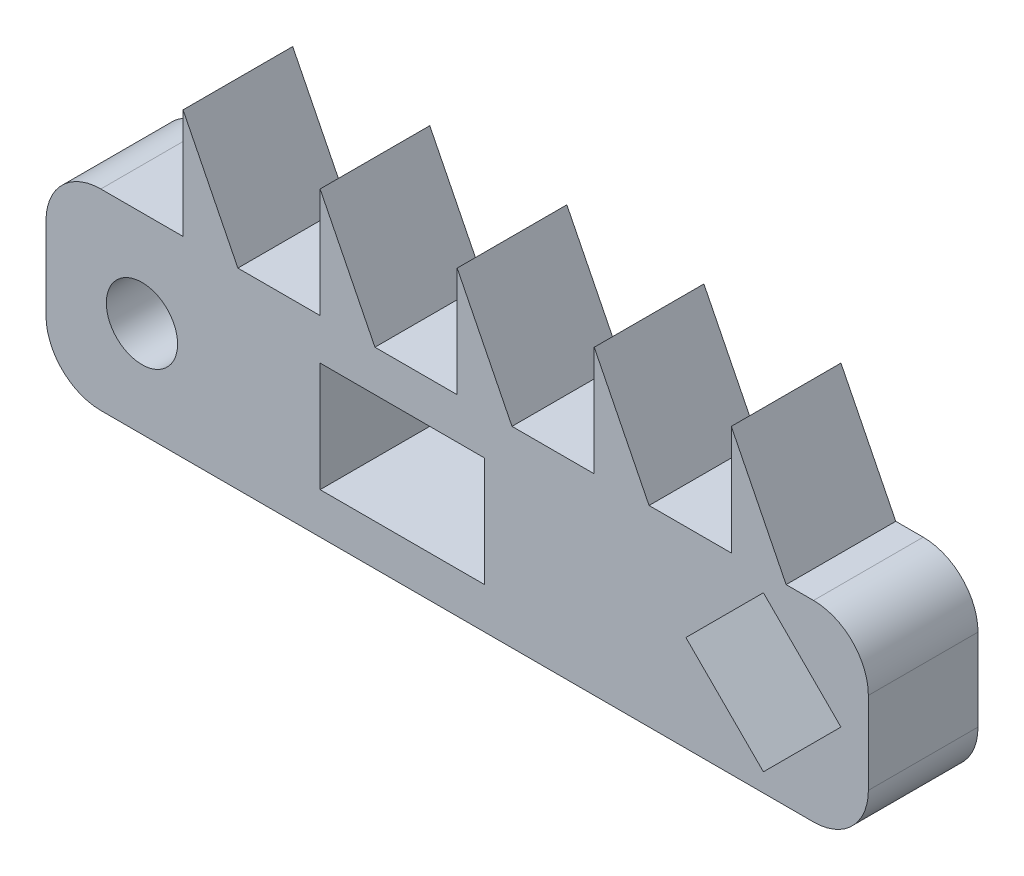
from build123d import *

# Parameters (mm, degrees)
SKETCH_1_R      = 1.3
SKETCH_1_W      = 6
SKETCH_1_H      = 4
EXTRUDE_1_DEPTH = 4
EXTRUDE_2_DEPTH = 4


with BuildPart() as part:
    # Эскиз1 → Бобышка-Вытянуть1 (new body)
    with BuildSketch(Plane.XY):
        with BuildLine():
            Line((2, 0), (28, 0))
            ThreePointArc((28, 0), (29.414213562, 0.585786438), (30, 2))
            Line((30, 2), (30, 5))
            ThreePointArc((30, 5), (29.414213562, 6.414213562), (28, 7))
            Line((28, 7), (2, 7))
            ThreePointArc((2, 7), (0.585786438, 6.414213562), (0, 5))
            Line((0, 5), (0, 2))
            ThreePointArc((0, 2), (0.585786438, 0.585786438), (2, 0))
        make_face()
        with Locations((3.5, 3.5)):
            Circle(SKETCH_1_R, mode=Mode.SUBTRACT)
        Polygon((23.343145751, 3.5), (26.171572875, 6.328427125), (29, 3.5), (26.171572875, 0.671572875), align=None, mode=Mode.SUBTRACT)
        with Locations((13, 3.5)):
            Rectangle(SKETCH_1_W, SKETCH_1_H, mode=Mode.SUBTRACT)
    extrude(amount=EXTRUDE_1_DEPTH)

    # Эскиз2 → Бобышка-Вытянуть2 (add)
    with BuildSketch(Plane.XY.offset(4)):
        Polygon((5, 7), (5, 11), (7, 7), align=None)
        Polygon((10, 7), (10, 11), (12, 7), align=None)
        Polygon((15, 7), (15, 11), (17, 7), align=None)
        Polygon((20, 7), (20, 11), (22, 7), align=None)
        Polygon((25, 7), (25, 11), (27, 7), align=None)
    extrude(amount=-EXTRUDE_2_DEPTH)


solid = part.part
